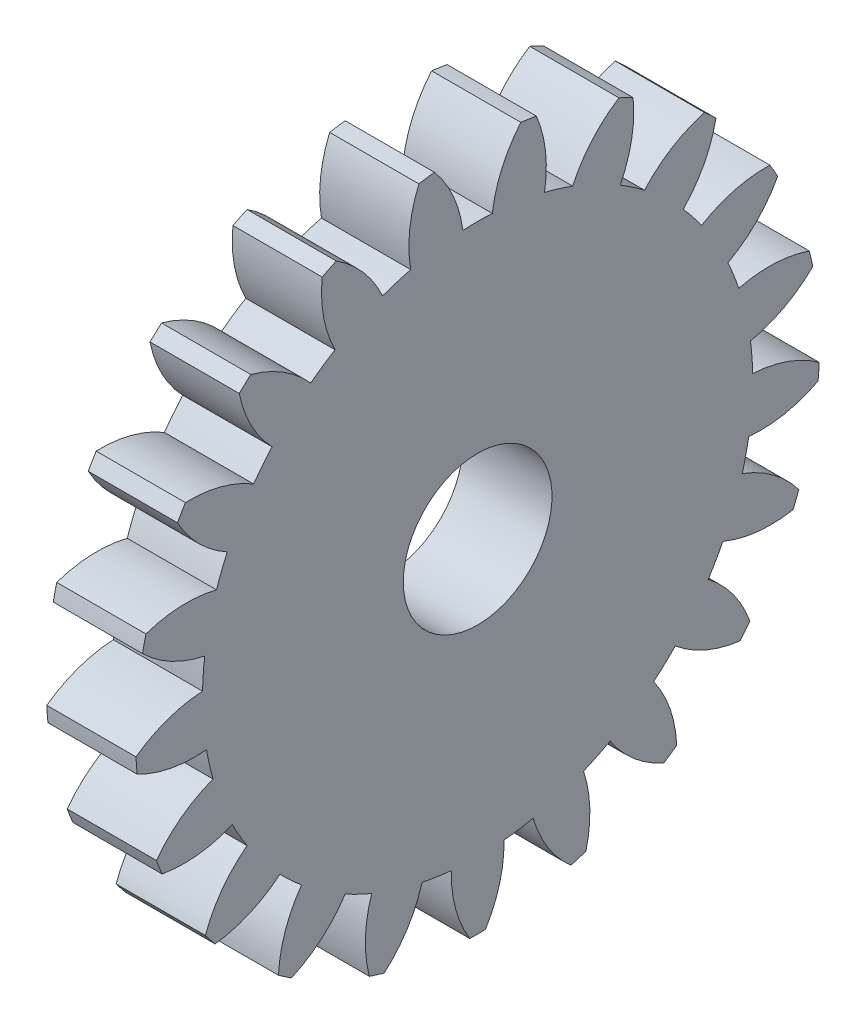
from build123d import *

# Parameters (mm, degrees)
BASPROSKE_W           = 12
BASPROSKE_H           = 11.5
TOOTHCUT_DEPTH        = 21.211382931
TEETHCUTS_COUNT       = 21
TEETHCUTS_ANGLE       = 342.857142857
BORSKE_R              = 2.5
BORE_DEPTH            = 50.0000508
CROQUIS1_W            = 26.748323755
CROQUIS1_H            = 25.378211712
CORTAR_EXTRUIR1_DEPTH = 9


with BuildPart() as part:
    # BasProSke → Base-Revolve (revolve)
    with BuildSketch(Plane(origin=(0, 0, 0), x_dir=(1, 0, 0), z_dir=(0, 1, 0)), mode=Mode.PRIVATE) as base_revolve_sk:
        with Locations((6, 5.75)):
            Rectangle(BASPROSKE_W, BASPROSKE_H)
    revolve(base_revolve_sk.sketch.rotate(Axis((-10, 0, 0), (1, 0, 0)), 180), axis=Axis((-10, 0, 0), (1, 0, 0)))

    # TooCutSke → ToothCut (cut, through all)
    with BuildSketch(Plane(origin=(0, 0, 0), x_dir=(0, 0, -1), z_dir=(1, 0, 0))):
        with BuildLine():
            ThreePointArc((0.49526894, 9.235730057), (0, 9.249), (-0.49526894, 9.235730057))
            ThreePointArc((-0.49526894, 9.235730057), (-0.823521057, 10.404716786), (-1.472455249, 11.430954496))
            ThreePointArc((-1.472455249, 11.430954496), (0, 11.5254), (1.472455249, 11.430954496))
            ThreePointArc((1.472455249, 11.430954496), (0.823521057, 10.404716786), (0.49526894, 9.235730057))
        make_face()
    toothcut = extrude(amount=TOOTHCUT_DEPTH, mode=Mode.SUBTRACT)

    # TeethCuts: ToothCut ×21 about axis
    teethcuts_axis = Axis((-10, 0, 0), (1, 0, 0))
    for i in range(1, TEETHCUTS_COUNT):
        add(toothcut.rotate(teethcuts_axis, i * TEETHCUTS_ANGLE / (TEETHCUTS_COUNT - 1)), mode=Mode.SUBTRACT)

    # BorSke → Bore (cut, symmetric)
    with BuildSketch(Plane(origin=(0, 0, 0), x_dir=(0, 0, -1), z_dir=(1, 0, 0))):
        with Locations(Location((0, 0, 0), (0, 0, 180))):
            Circle(BORSKE_R)
    extrude(amount=BORE_DEPTH, both=True, mode=Mode.SUBTRACT)

    # Croquis1 → Cortar-Extruir1 (cut)
    with BuildSketch(Plane.ZY):
        with Locations((0.685056021, -0.030498092)):
            Rectangle(CROQUIS1_W, CROQUIS1_H)
    extrude(amount=-CORTAR_EXTRUIR1_DEPTH, mode=Mode.SUBTRACT)


solid = part.part
